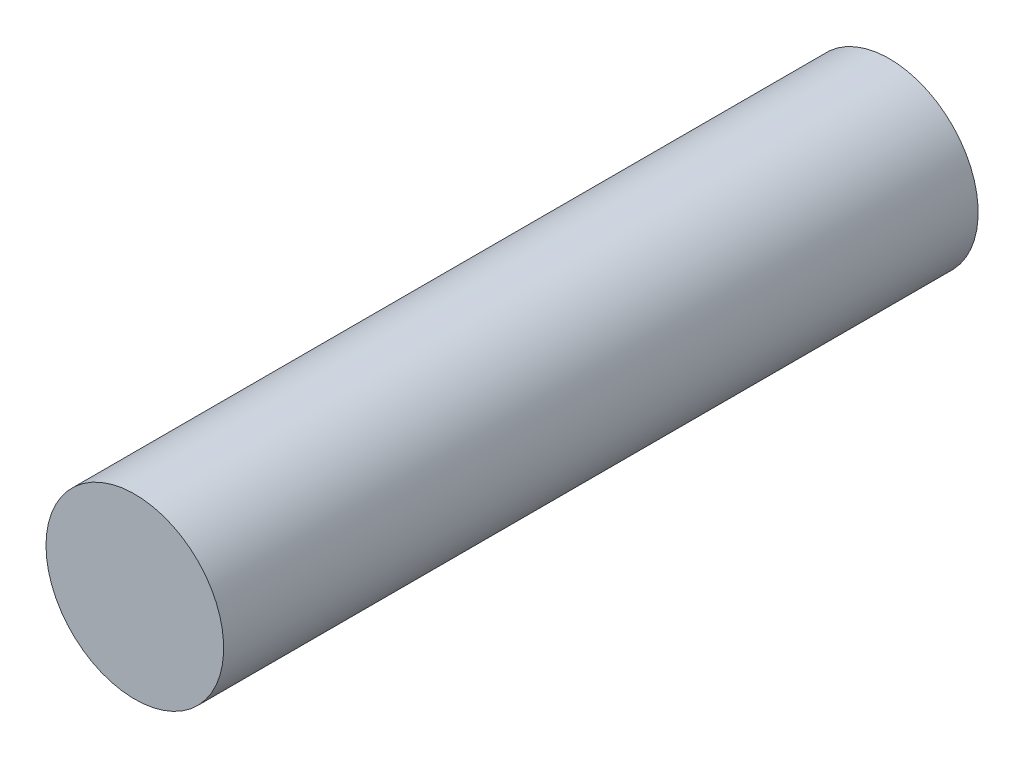
from build123d import *

# Parameters (mm, degrees)
ESQUISSE1_R      = 3.25
EXTRUSION1_DEPTH = 27.6


with BuildPart() as part:
    # Esquisse1 → Extrusion1 (new body)
    with BuildSketch(Plane.XY):
        with Locations(Location((0, 0, 0), (0, 0, 180))):
            Circle(ESQUISSE1_R)
    extrude(amount=EXTRUSION1_DEPTH)


solid = part.part
